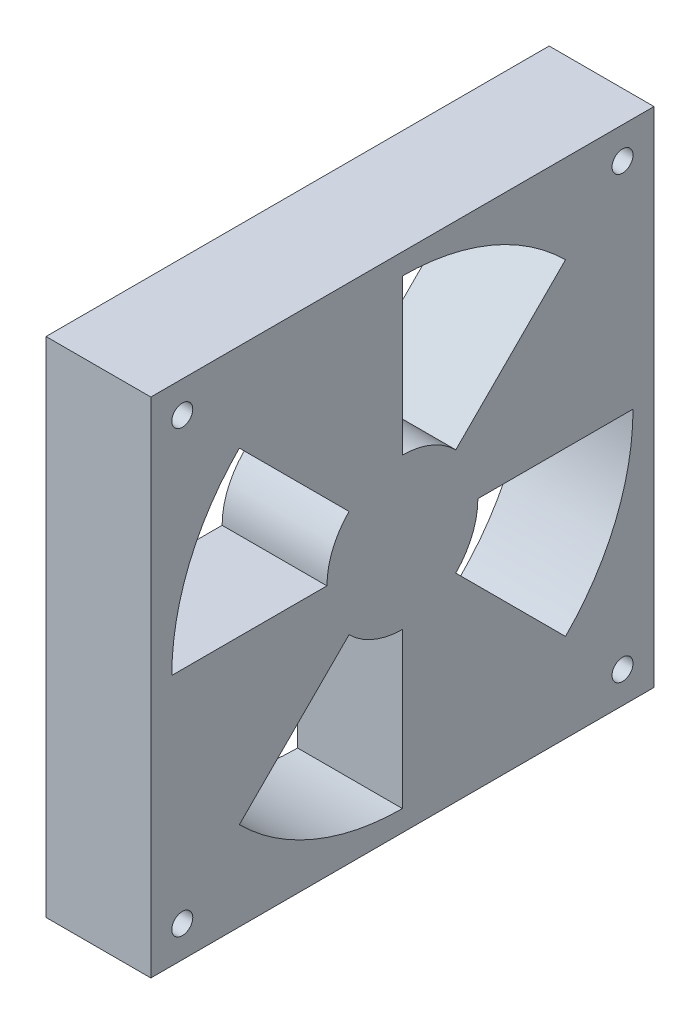
from build123d import *

# Parameters (mm, degrees)
SKETCH_1_W      = 120
SKETCH_1_H      = 120
SKETCH_1_R      = 2.5
SKETCH_1_R_2    = 55
SKETCH_1_R_3    = 18
EXTRUDE_1_DEPTH = 25


with BuildPart() as part:
    # 草图1 → 凸台-拉伸1 (new body)
    # profile 1 of 6: a face of its own
    with BuildSketch(Plane(origin=(0, 0, 0), x_dir=(0, 0, -1), z_dir=(1, 0, 0))):
        with Locations((60, -60)):
            Rectangle(SKETCH_1_W, SKETCH_1_H)
        with Locations((7.5, -112.5)):
            Circle(SKETCH_1_R, mode=Mode.SUBTRACT)
        with Locations((112.5, -112.5)):
            Circle(SKETCH_1_R, mode=Mode.SUBTRACT)
        with Locations((112.5, -7.5)):
            Circle(SKETCH_1_R, mode=Mode.SUBTRACT)
        with Locations((7.5, -7.5)):
            Circle(SKETCH_1_R, mode=Mode.SUBTRACT)
        with Locations((60, -60)):
            Circle(SKETCH_1_R_2, mode=Mode.SUBTRACT)
    # profile 2 of 6: a face of its own
    with BuildSketch(Plane(origin=(0, 0, 0), x_dir=(0, 0, -1), z_dir=(1, 0, 0))):
        with Locations((60, -60)):
            Circle(SKETCH_1_R_3)
    # profile 3 of 6: a face of its own
    with BuildSketch(Plane(origin=(0, 0, 0), x_dir=(0, 0, -1), z_dir=(1, 0, 0))):
        with BuildLine():
            ThreePointArc((47.272077939, -47.272077939), (53.111698217, -43.370168415), (60, -42))
            Line((60, -42), (60, -5))
            ThreePointArc((60, -5), (38.95241122, -9.186625712), (21.109127035, -21.109127035))
            Line((21.109127035, -21.109127035), (47.272077939, -47.272077939))
        make_face()
    # profile 4 of 6: a face of its own
    with BuildSketch(Plane(origin=(0, 0, 0), x_dir=(0, 0, -1), z_dir=(1, 0, 0))):
        with BuildLine():
            Line((98.890872965, -21.109127035), (72.727922061, -47.272077939))
            ThreePointArc((72.727922061, -47.272077939), (76.629831585, -53.111698217), (78, -60))
            Line((78, -60), (115, -60))
            ThreePointArc((115, -60), (110.813374288, -38.95241122), (98.890872965, -21.109127035))
        make_face()
    # profile 5 of 6: a face of its own
    with BuildSketch(Plane(origin=(0, 0, 0), x_dir=(0, 0, -1), z_dir=(1, 0, 0))):
        with BuildLine():
            Line((98.890872965, -98.890872965), (72.727922061, -72.727922061))
            ThreePointArc((72.727922061, -72.727922061), (66.888301783, -76.629831585), (60, -78))
            Line((60, -78), (60, -115))
            ThreePointArc((60, -115), (81.04758878, -110.813374288), (98.890872965, -98.890872965))
        make_face()
    # profile 6 of 6: a face of its own
    with BuildSketch(Plane(origin=(0, 0, 0), x_dir=(0, 0, -1), z_dir=(1, 0, 0))):
        with BuildLine():
            ThreePointArc((47.272077939, -72.727922061), (43.370168415, -66.888301783), (42, -60))
            Line((42, -60), (5, -60))
            ThreePointArc((5, -60), (9.186625712, -81.04758878), (21.109127035, -98.890872965))
            Line((21.109127035, -98.890872965), (47.272077939, -72.727922061))
        make_face()
    extrude(amount=EXTRUDE_1_DEPTH)


solid = part.part
